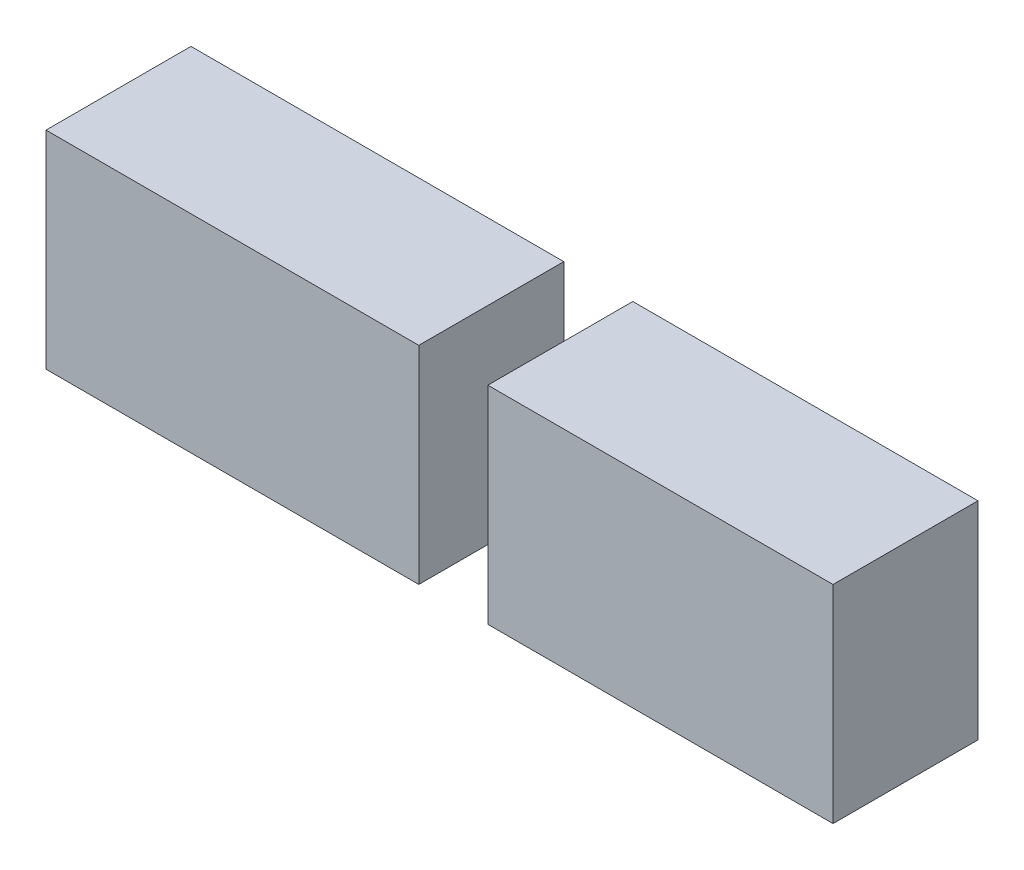
from build123d import *

# Parameters (mm, degrees)
ESQUISSE1_W        = 50
ESQUISSE1_H        = 30
BOSS_EXTRU_1_DEPTH = 21
ESQUISSE3_W        = 21
ESQUISSE3_H        = 30
BOSS_EXTRU_3_DEPTH = 54


with BuildPart() as part:
    # Esquisse1 → Boss.-Extru.1 (new body)
    with BuildSketch(Plane.XY):
        with Locations((25, 15)):
            Rectangle(ESQUISSE1_W, ESQUISSE1_H)
    extrude(amount=BOSS_EXTRU_1_DEPTH)


with BuildPart() as body_2:
    # Esquisse3 → Boss.-Extru.3 (new body)
    with BuildSketch(Plane.ZY.offset(10)):
        with Locations((10.5, 15)):
            Rectangle(ESQUISSE3_W, ESQUISSE3_H)
    extrude(amount=BOSS_EXTRU_3_DEPTH)


solid = Compound([part.part, body_2.part])
